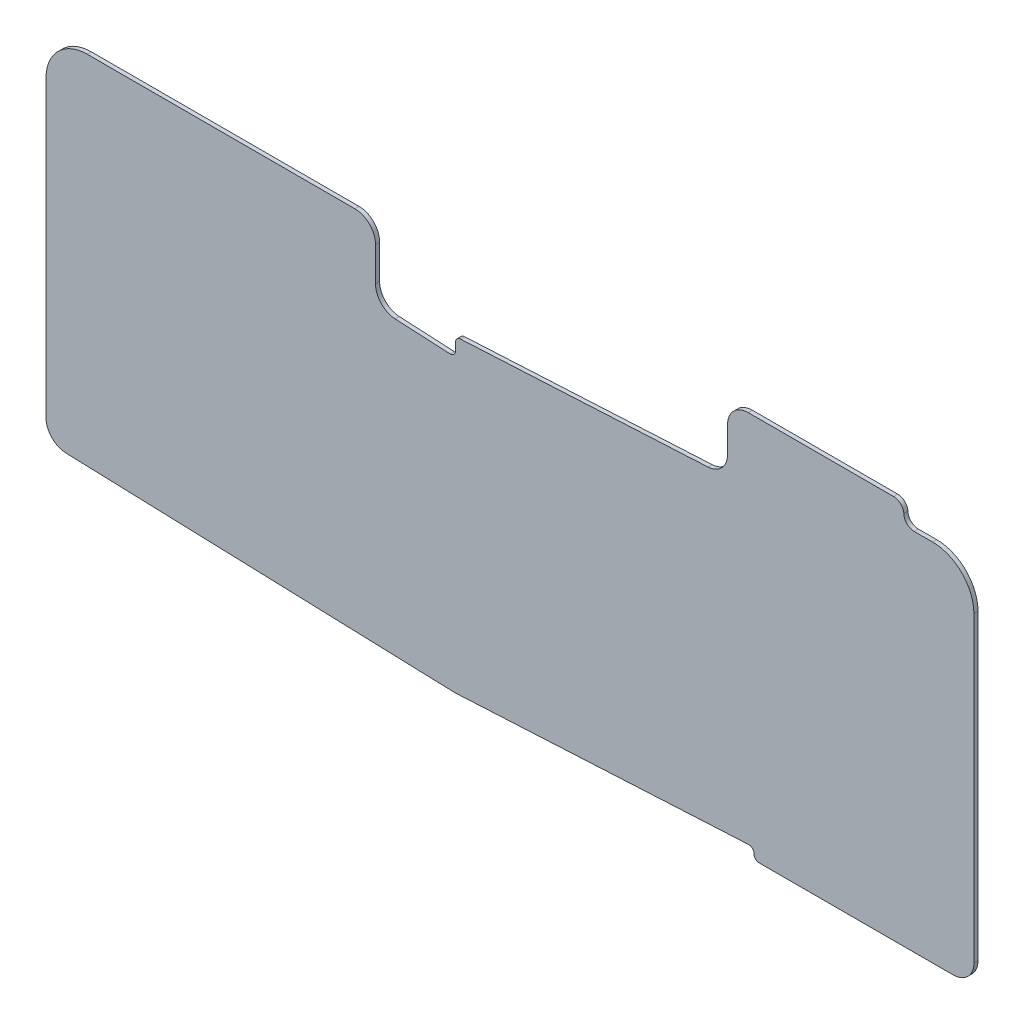
from build123d import *

# Parameters (mm, degrees)
ESTRUSIONE_ESTRUSIONE2_DEPTH = 1.6


with BuildPart() as part:
    # bordo2 → Estrusione-Estrusione2 (new body)
    with BuildSketch(Plane.XY):
        with BuildLine():
            Line((201, 97.893856635), (201, -7.091597346))
            ThreePointArc((201, -7.091597346), (198.656854249, -12.748451596), (193, -15.091597346))
            Line((193, -15.091597346), (117.750790543, -15.091597346))
            ThreePointArc((117.750790543, -15.091597346), (116.336576981, -14.505810909), (115.750790543, -13.091597346))
            Line((115.750790543, -13.091597346), (115.750790543, -12.967534141))
            ThreePointArc((115.750790543, -12.967534141), (115.127499694, -11.516785399), (113.64611863, -10.970275071))
            Line((113.64611863, -10.970275071), (0.928841556, -16.877537249))
            ThreePointArc((0.928841556, -16.877537249), (-0.145141858, -16.910699844), (-1.219558299, -16.897682863))
            Line((-1.219558299, -16.897682863), (-151.023233988, -11.861429997))
            ThreePointArc((-151.023233988, -11.861429997), (-156.505538032, -9.426954116), (-158.754433684, -3.865947122))
            Line((-158.754433684, -3.865947122), (-158.754433684, 95.67986032))
            Line((-158.754433684, 95.67986032), (-158.754433684, 110.187089821))
            ThreePointArc((-158.754433684, 110.187089821), (-154.068142183, 121.50079832), (-142.754433684, 126.187089821))
            Line((-142.754433684, 126.187089821), (-39, 126.187089821))
            ThreePointArc((-39, 126.187089821), (-33.343145751, 123.843944071), (-31, 118.187089821))
            Line((-31, 118.187089821), (-31, 105.006491693))
            ThreePointArc((-31, 105.006491693), (-28.802994968, 99.499655087), (-23.41868765, 97.017455415))
            Line((-23.41868765, 97.017455415), (-2.104671912, 95.900435182))
            ThreePointArc((-2.104671912, 95.900435182), (-0.623290849, 96.44694551), (0, 97.897694252))
            Line((0, 97.897694252), (0, 100.897694252))
            ThreePointArc((0, 100.897694252), (0.549251258, 102.274403403), (1.895328088, 102.894953321))
            Line((1.895328088, 102.894953321), (97.91868765, 107.927324355))
            ThreePointArc((97.91868765, 107.927324355), (103.302994968, 110.409524028), (105.5, 115.916360633))
            Line((105.5, 115.916360633), (105.5, 126))
            ThreePointArc((105.5, 126), (107.843145751, 131.656854249), (113.5, 134))
            Line((113.5, 134), (169.851790543, 134))
            ThreePointArc((169.851790543, 134), (172.680217668, 132.828427125), (173.851790543, 130))
            Line((173.851790543, 130), (173.851790543, 130.276535982))
            ThreePointArc((173.851790543, 130.276535982), (175.023363418, 127.448108857), (177.851790543, 126.276535982))
            Line((177.851790543, 126.276535982), (185, 126.276535982))
            ThreePointArc((185, 126.276535982), (196.313708499, 121.590244481), (201, 110.276535982))
            Line((201, 110.276535982), (201, 97.893856635))
        make_face()
    extrude(amount=ESTRUSIONE_ESTRUSIONE2_DEPTH)


solid = part.part
